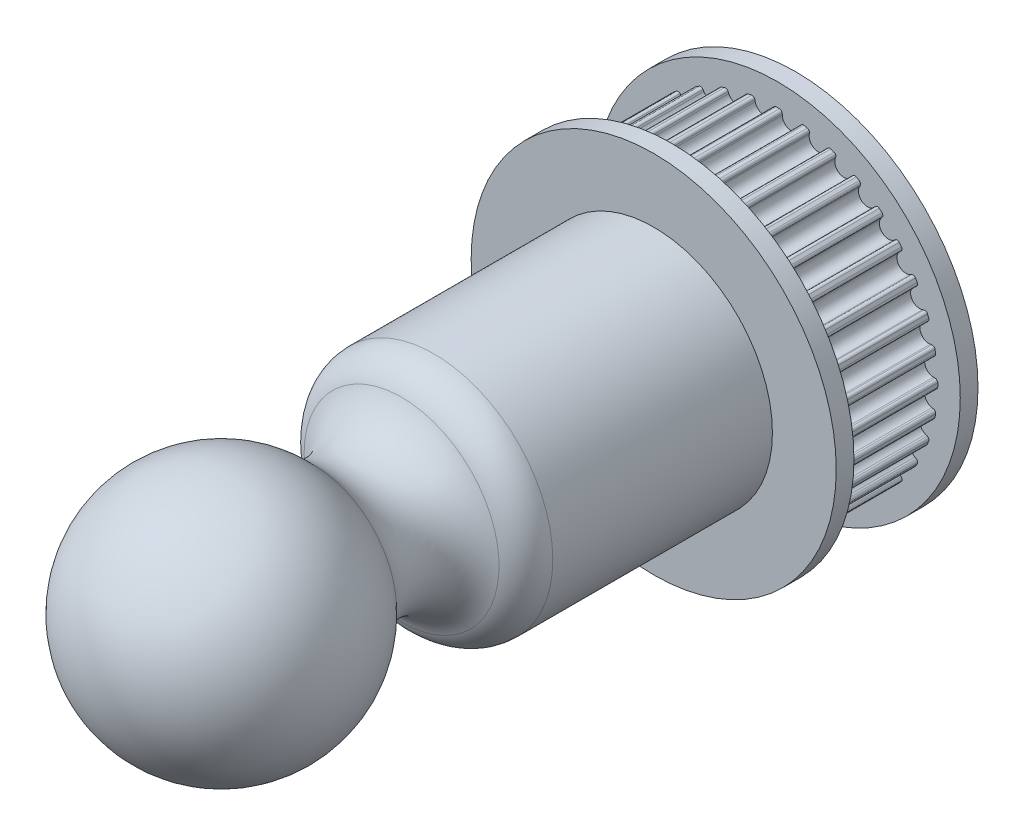
from build123d import *

# Parameters (mm, degrees)
SKETCH2_R         = 45.15
EXTRUDE1_DEPTH    = 30
EXTRUDE2_DEPTH    = 30
CIRPATTERN1_COUNT = 36
SKETCH3_R         = 51.5
EXTRUDE3_DEPTH    = 5
EXTRUDE4_START    = 5
SKETCH4_R         = 51.5
EXTRUDE4_DEPTH    = 5


with BuildPart() as part:
    # Sketch2 → Extrude1 (new body)
    with BuildSketch(Plane.XY):
        Circle(SKETCH2_R)
    extrude(amount=EXTRUDE1_DEPTH)

    # Sketch1 → Extrude2 (cut)
    with BuildSketch(Plane.XY):
        with BuildLine():
            Line((-1.265610805, 44.394558923), (-1.282106289, 43.922190055))
            ThreePointArc((-1.282106289, 43.922190055), (-3.626550456, 41.451661388), (-6.364380048, 43.477548716))
            Line((-6.364380048, 43.477548716), (-6.462650922, 43.939876828))
            ThreePointArc((-6.462650922, 43.939876828), (-6.785899963, 44.421956093), (-7.352628199, 44.547293504))
            ThreePointArc((-7.352628199, 44.547293504), (-3.935081785, 44.978190619), (-0.494631081, 45.147290507))
            ThreePointArc((-0.494631081, 45.147290507), (-1.030984829, 44.925445927), (-1.265610805, 44.394558923))
        make_face()
    extrude2 = extrude(amount=EXTRUDE2_DEPTH, mode=Mode.SUBTRACT)

    # CirPattern1: Extrude2 ×36 about axis
    cirpattern1_axis = Axis((0, 0, 0), (0, 0, 1))
    for i in range(1, CIRPATTERN1_COUNT):
        add(extrude2.rotate(cirpattern1_axis, i * 360 / CIRPATTERN1_COUNT), mode=Mode.SUBTRACT)

    # Sketch3 → Extrude3 (add)
    with BuildSketch(Plane.XY.offset(30)):
        Circle(SKETCH3_R)
    extrude(amount=EXTRUDE3_DEPTH)

    # Sketch4 → Extrude4 (add)
    with BuildSketch(Plane(origin=(0, 0, 0), x_dir=(-1, 0, 0), z_dir=(0, 0, -1)).offset(EXTRUDE4_START)):
        with Locations(Location((0, 0, 0), (0, 0, 180))):
            Circle(SKETCH4_R)
    extrude(amount=-EXTRUDE4_DEPTH)

    # Sketch8 → Revolve2 (revolve)
    with BuildSketch(Plane(origin=(0, 0, 0), x_dir=(1, 0, 0), z_dir=(0, 1, 0)), mode=Mode.PRIVATE) as revolve2_sk:
        with BuildLine():
            Line((33.5, -35), (33.5, -96.969066619))
            ThreePointArc((33.5, -96.969066619), (31.866600265, -102.446292194), (27.5, -106.134218009))
            ThreePointArc((27.5, -106.134218009), (18.694820727, -117.472242481), (23.45, -131.017361566))
            ThreePointArc((23.45, -131.017361566), (32.667968602, -169.561999339), (0, -192))
            Line((0, -192), (0, -35))
            Line((0, -35), (33.5, -35))
        make_face()
    revolve(revolve2_sk.sketch.rotate(Axis((0, 0, 35), (0, 0, 1)), 180), axis=Axis((0, 0, 35), (0, 0, 1)))


solid = part.part
